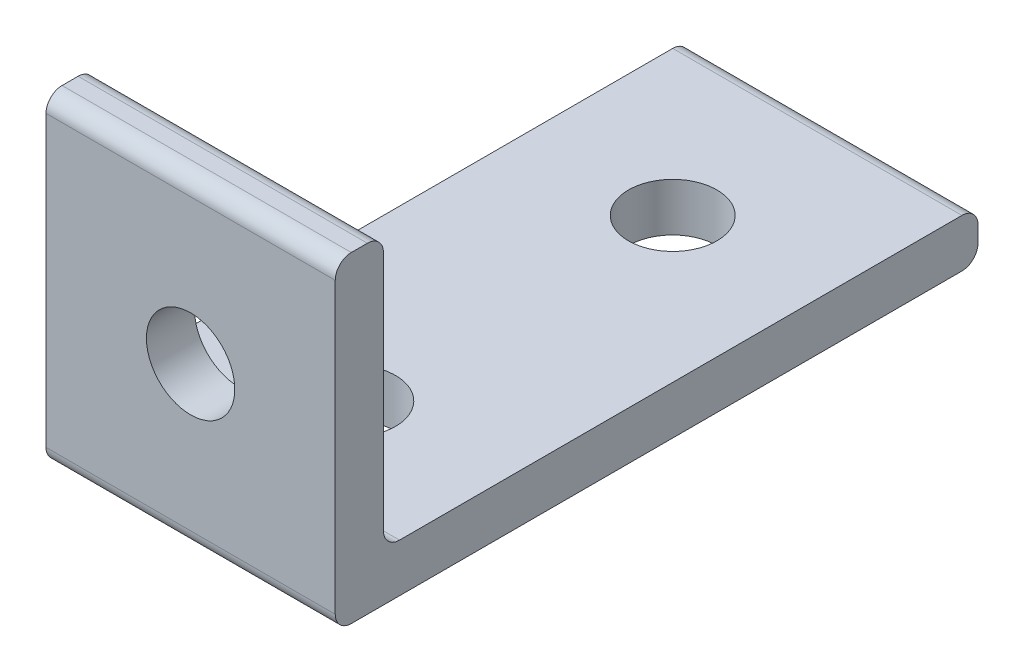
from build123d import *

# Parameters (mm, degrees)
SKETCH_1_W          = 40
SKETCH_1_H          = 20
EXTRUDE_1_DEPTH     = 18
SKETCH_2_W          = 37
SKETCH_2_H          = 17
CUT_EXTRUDE_1_DEPTH = 18
SKETCH_3_R          = 2.75
CUT_EXTRUDE_2_DEPTH = 18
SKETCH_4_R          = 2.75
CUT_EXTRUDE_3_DEPTH = 18
FILLET_1_R          = 1


with BuildPart() as part:
    # 草图1 → 凸台-拉伸1 (new body)
    with BuildSketch(Plane(origin=(0, 0, 0), x_dir=(0, 0, -1), z_dir=(1, 0, 0))):
        with Locations((20, 10)):
            Rectangle(SKETCH_1_W, SKETCH_1_H)
    extrude(amount=EXTRUDE_1_DEPTH)

    # 草图2 → 切除-拉伸1 (cut)
    with BuildSketch(Plane(origin=(18, 0, 0), x_dir=(0, 0, -1), z_dir=(1, 0, 0))):
        with Locations((21.5, 11.5)):
            Rectangle(SKETCH_2_W, SKETCH_2_H)
    extrude(amount=-CUT_EXTRUDE_1_DEPTH, mode=Mode.SUBTRACT)

    # 草图3 → 切除-拉伸2 (cut)
    with BuildSketch(Plane(origin=(0, 0, -3), x_dir=(-1, 0, 0), z_dir=(0, 0, -1))):
        with Locations((-9, 10)):
            Circle(SKETCH_3_R)
    extrude(amount=-CUT_EXTRUDE_2_DEPTH, mode=Mode.SUBTRACT)

    # 草图4 → 切除-拉伸3 (cut)
    with BuildSketch(Plane(origin=(0, 3, 0), x_dir=(1, 0, 0), z_dir=(0, 1, 0))):
        with Locations(Location((9, 30, 0), (0, 0, 270))):
            Circle(SKETCH_4_R)
        with Locations(Location((9, 10, 0), (0, 0, 270))):
            Circle(SKETCH_4_R)
    extrude(amount=-CUT_EXTRUDE_3_DEPTH, mode=Mode.SUBTRACT)

    # 圆角1
    fillet_1_edges = [part.edges().sort_by_distance(p)[0] for p in [
        (9, 20, -3),
        (9, 3, -40),
        (9, 3, -3),
        (9, 20, 0),
        (9, 0, -40),
        (9, 0, 0),
    ]]
    fillet(fillet_1_edges, radius=FILLET_1_R)


solid = part.part
